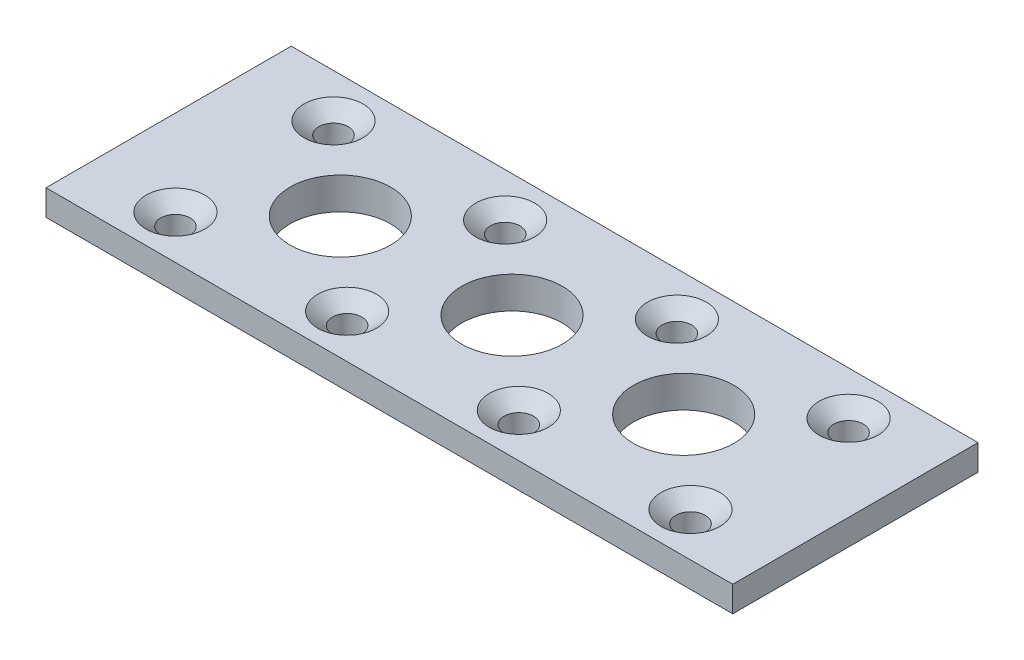
from build123d import *

# Parameters (mm, degrees)
SKETCH1_W                                         = 140
SKETCH1_H                                         = 50
BOSS_EXTRUDE2_DEPTH                               = 6.5
SKETCH2_R                                         = 10.25
CUT_EXTRUDE1_DEPTH                                = 12.7
LPATTERN1_COUNT                                   = 2
LPATTERN1_PITCH                                   = 35
LPATTERN1_COL_COUNT                               = 2
LPATTERN1_COL_PITCH                               = 35
CSK_FOR_6_FLAT_HEAD_MACHINE_SCREW_100_D           = 6
CSK_FOR_6_FLAT_HEAD_MACHINE_SCREW_100_CSINK_D     = 12
CSK_FOR_6_FLAT_HEAD_MACHINE_SCREW_100_CSINK_ANGLE = 100
LPATTERN2_COUNT                                   = 4
LPATTERN2_PITCH                                   = 35
LPATTERN2_COUNT_DIR2                              = 2
LPATTERN2_PITCH_DIR2                              = 32.2199
CHAMFER1_SIZE                                     = 1.27


with BuildPart() as part:
    # Sketch1 → Boss-Extrude2 (new body)
    with BuildSketch(Plane(origin=(0, 0, 0), x_dir=(1, 0, 0), z_dir=(0, 1, 0))):
        Rectangle(SKETCH1_W, SKETCH1_H)
    extrude(amount=BOSS_EXTRUDE2_DEPTH)

    # Sketch2 → Cut-Extrude1 (cut)
    with BuildSketch(Plane(origin=(0, 6.5, 0), x_dir=(1, 0, 0), z_dir=(0, 1, 0))):
        with Locations(Location((0, 0, 0), (0, 0, 270))):
            Circle(SKETCH2_R)
    cut_extrude1 = extrude(amount=-CUT_EXTRUDE1_DEPTH, mode=Mode.SUBTRACT)

    # LPattern1: Cut-Extrude1 ×2
    with Locations(*[(i * LPATTERN1_PITCH, 0, 0) for i in range(1, LPATTERN1_COUNT)]):
        add(cut_extrude1, mode=Mode.SUBTRACT)

    # LPattern1 col: Cut-Extrude1 ×2
    with Locations(*[(-i * LPATTERN1_COL_PITCH, 0, 0) for i in range(1, LPATTERN1_COL_COUNT)]):
        add(cut_extrude1, mode=Mode.SUBTRACT)

    # CSK for #6 Flat Head Machine Screw (100)1 (through all)
    with Locations(Plane(origin=(0, 6.5, 0), x_dir=(1, 0, 0), z_dir=(0, 1, 0))):
        with Locations((-52.5, 16.11)):
            csk_for_6_flat_head_machine_screw_100 = CounterSinkHole(CSK_FOR_6_FLAT_HEAD_MACHINE_SCREW_100_D / 2, CSK_FOR_6_FLAT_HEAD_MACHINE_SCREW_100_CSINK_D / 2, counter_sink_angle=CSK_FOR_6_FLAT_HEAD_MACHINE_SCREW_100_CSINK_ANGLE)

    # LPattern2: CSK for _6 Flat Head Machine Screw _100 4 × 2
    with Locations(*[(i * LPATTERN2_PITCH, 0, j * LPATTERN2_PITCH_DIR2) for i in range(LPATTERN2_COUNT) for j in range(LPATTERN2_COUNT_DIR2) if (i, j) != (0, 0)]):
        add(csk_for_6_flat_head_machine_screw_100, mode=Mode.SUBTRACT)

    # Chamfer1
    chamfer1_edges = [part.edges().sort_by_distance(p)[0] for p in [
        (0, 0, 25),
        (-70, 0, 0),
        (0, 0, -25),
        (70, 0, 0),
    ]]
    chamfer(chamfer1_edges, length=CHAMFER1_SIZE)


solid = part.part
